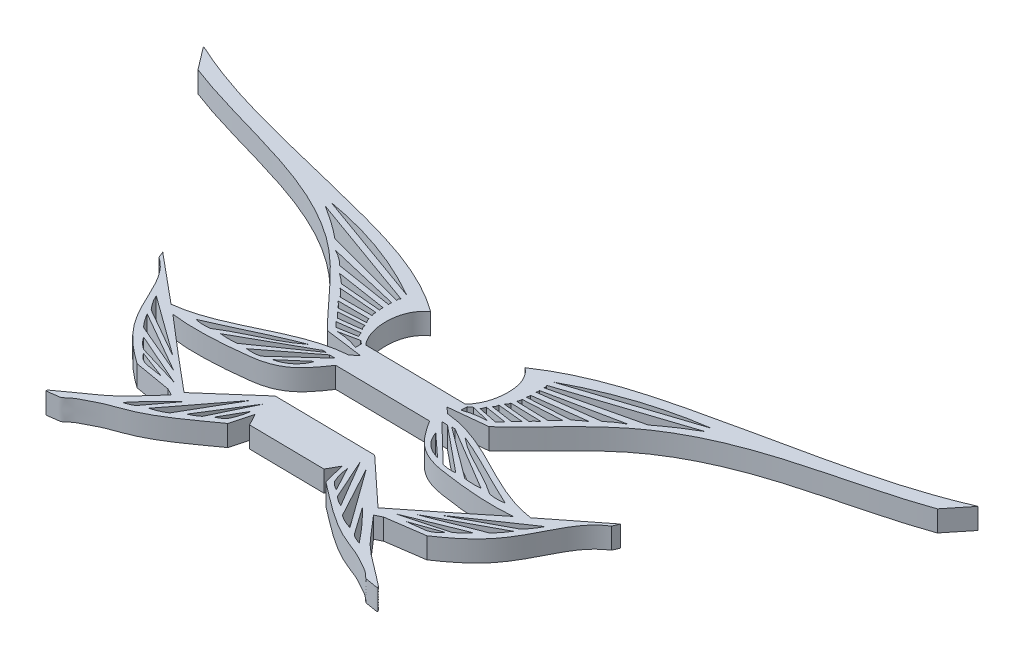
from build123d import *

# Parameters (mm, degrees)
EXTRUDE_2_DEPTH = 5


with BuildPart() as part:
    # 草图1 → 凸台-拉伸2 (new body)
    with BuildSketch(Plane(origin=(0, 0, 0), x_dir=(1, 0, 0), z_dir=(0, 1, 0))):
        with BuildLine():
            Line((-16.103773819, -29.898359089), (-14.490886088, -30.755289496))
            add(Edge.make_bspline(
                [(-14.490886088, -30.755289496), (-20.884669309, -37.499295163), (-18.447995148, -36.236440216), (-31.189451968, -45.028910304), (-26.993954421, -44.438191538), (-27.357635824, -44.648190251), (-25.248865907, -42.845555476), (-23.405980948, -42.044069648), (-20.595558929, -40.429081018), (-12.612070301, -38.071297427), (-6.528604055, -33.194707099), (-1.848850836, -29.898359089)],
                knots=[0, 0, 0, 0, 0.138213288, 0.158313918, 0.168524285, 0.240316957, 0.287507408, 0.343449858, 0.409538759, 0.538479735, 1, 1, 1, 1], degree=3))
            Line((-1.848850836, -29.898359089), (-0.445645395, -24.742363794))
            Line((-0.445645395, -24.742363794), (1.065498926, -27.584754302))
            Line((1.065498926, -27.584754302), (19.077453467, -27.839259259))
            Line((19.077453467, -27.839259259), (20.668303178, -25.040699244))
            Line((20.668303178, -25.040699244), (21.925271354, -30.234282207))
            add(Edge.make_bspline(
                [(34.538047989, -31.448057553), (40.738734082, -38.370020301), (38.338713296, -37.038823918), (50.82666171, -46.187779954), (46.649529217, -45.478757766), (47.007132144, -45.698948069), (44.950135591, -43.83745193), (43.130631467, -42.984217349), (40.366961188, -41.290468021), (32.453276369, -38.708060865), (26.510021564, -33.661535614), (21.925271354, -30.234282207)],
                knots=[0, 0, 0, 0, 0.138213288, 0.158313918, 0.168524285, 0.240316957, 0.287507408, 0.343449858, 0.409538759, 0.538479735, 1, 1, 1, 1], degree=3))
            Line((34.538047989, -31.448057553), (36.174503464, -30.63703965))
            Line((36.174503464, -30.63703965), (45.171670829, -29.346902954))
            add(Edge.make_bspline(
                [(65.249495162, -5.273250668), (61.766263907, -7.501627612), (58.752904031, -13.633337302), (53.744023944, -23.084612304), (48.232629608, -27.292598923), (45.171670829, -29.346902954)],
                knots=[0, 0, 0, 0, 0.362458305, 0.64917474, 1, 1, 1, 1], degree=3))
            Line((65.249495162, -5.273250668), (65.893558852, -3.785938561))
            Line((65.893558852, -3.785938561), (53.873583233, -13.221108944))
            add(Edge.make_bspline(
                [(22.461513178, -1.624515792), (33.855828878, -2.720380763), (42.541642387, -11.597724795), (53.873583233, -13.221108944)],
                knots=[0, 0, 0, 0, 1, 1, 1, 1], degree=3))
            Line((22.461513178, -1.624515792), (20.921904443, -0.295621909))
            Line((20.921904443, -0.295621909), (30.060393929, 0.666159162))
            add(Edge.make_bspline(
                [(100.611993759, 37.211299403), (88.298262435, 32.83638113), (69.501657366, 30.01745681), (45.090813635, 17.335397796), (36.097400095, 6.236393186), (30.060393929, 0.666159162)],
                knots=[0, 0, 0, 0, 0.482735813, 0.695059024, 1, 1, 1, 1], degree=3))
            Line((100.611993759, 37.211299403), (104.954981583, 42.59415762))
            add(Edge.make_bspline(
                [(22.144921218, 17.160212546), (31.525905639, 23.57487669), (47.510430234, 27.686769801), (75.810112282, 33.739350726), (93.315699901, 37.547379753), (104.954981583, 42.59415762)],
                knots=[0, 0, 0, 0, 0.384359586, 0.564437476, 1, 1, 1, 1], degree=3))
            add(Edge.make_bspline(
                [(22.144921218, 17.160212546), (24.509893208, 15.323249999), (25.990560817, 9.903430905), (24.36483621, 4.419213059), (22.577706713, 2.486317386)],
                knots=[0, 0, 0, 0, 0.513587115, 1, 1, 1, 1], degree=3))
            Line((22.577706713, 2.486317386), (-1.57654055, 2.827611588))
            add(Edge.make_bspline(
                [(-0.729332783, 17.483420725), (-3.145262015, 15.71401126), (-4.778469642, 10.338190539), (-3.308344707, 4.81022902), (-1.57654055, 2.827611588)],
                knots=[0, 0, 0, 0, 0.513587115, 1, 1, 1, 1], degree=3))
            add(Edge.make_bspline(
                [(-0.729332783, 17.483420725), (-9.925332708, 24.160573572), (-25.787298838, 28.722450593), (-53.904673908, 35.572192129), (-71.295681173, 39.873302368), (-82.787724947, 45.246920776)],
                knots=[0, 0, 0, 0, 0.384359586, 0.564437476, 1, 1, 1, 1], degree=3))
            Line((-82.787724947, 45.246920776), (-78.598557779, 39.743505086))
            add(Edge.make_bspline(
                [(-78.598557779, 39.743505086), (-66.413350951, 35.022422204), (-47.703895554, 31.673545498), (-23.661115032, 18.306847429), (-14.984882238, 6.958174602), (-9.107667118, 1.219595251)],
                knots=[0, 0, 0, 0, 0.482735813, 0.695059024, 1, 1, 1, 1], degree=3))
            Line((-9.107667118, 1.219595251), (0, 0))
            Line((0, 0), (-1.57654055, -1.284863379))
            add(Edge.make_bspline(
                [(-1.57654055, -1.284863379), (-12.997269873, -2.058356781), (-21.930435578, -10.686748512), (-33.303719432, -11.989312829)],
                knots=[0, 0, 0, 0, 1, 1, 1, 1], degree=3))
            Line((-33.303719432, -11.989312829), (-45.052315875, -2.218297749))
            Line((-45.052315875, -2.218297749), (-44.450531705, -3.723213413))
            add(Edge.make_bspline(
                [(-44.450531705, -3.723213413), (-41.031651414, -6.049115675), (-38.192739367, -12.263516681), (-33.452894494, -21.852539022), (-28.062592541, -26.214564213), (-25.060897902, -28.354532203)],
                knots=[0, 0, 0, 0, 0.362458305, 0.64917474, 1, 1, 1, 1], degree=3))
            Line((-25.060897902, -28.354532203), (-16.103773819, -29.898359089))
        make_face()
        with BuildLine():
            Line((-35.182838385, 28.178383105), (-7.096711501, 18.095243558))
            add(Edge.make_bspline(
                [(-35.182838385, 28.178383105), (-20.248090795, 25.642813669), (-7.096711501, 18.095243558)],
                knots=[0, 0, 0, 1, 1, 1], degree=2))
        make_face(mode=Mode.SUBTRACT)
        with BuildLine():
            Line((-27.226324633, 21.101852441), (-7.096711501, 15.748621991))
            add(Edge.make_bspline(
                [(-6.962377893, 16.59490624), (-7.386571889, 16.214051513), (-7.096711501, 15.748621991)],
                knots=[0, 0, 0, 1, 1, 1], degree=2))
            Line((-6.962377893, 16.59490624), (-35.182838385, 26.748410587))
            add(Edge.make_bspline(
                [(-35.182838385, 26.748410587), (-31.011643798, 24.200471227), (-27.226324633, 21.101852441)],
                knots=[0, 0, 0, 1, 1, 1], degree=2))
        make_face(mode=Mode.SUBTRACT)
        with BuildLine():
            Line((-21.139774943, 16.152868078), (-7.096711501, 13.89645491))
            add(Edge.make_bspline(
                [(-7.212800722, 14.662905206), (-7.429805602, 14.248762569), (-7.096711501, 13.89645491)],
                knots=[0, 0, 0, 1, 1, 1], degree=2))
            Line((-7.212800722, 14.662905206), (-24.774009417, 18.797669248))
            add(Edge.make_bspline(
                [(-24.774009417, 18.797669248), (-22.73761671, 17.753086901), (-21.139774943, 16.152868078)],
                knots=[0, 0, 0, 1, 1, 1], degree=2))
        make_face(mode=Mode.SUBTRACT)
        with BuildLine():
            Line((-17.203335074, 12.610095473), (-7.096711501, 11.704444121))
            add(Edge.make_bspline(
                [(-7.212800722, 12.610095473), (-7.346401022, 12.118621353), (-7.096711501, 11.704444121)],
                knots=[0, 0, 0, 1, 1, 1], degree=2))
            Line((-7.212800722, 12.610095473), (-19.618405347, 14.542151692))
            add(Edge.make_bspline(
                [(-19.618405347, 14.542151692), (-18.328722121, 13.678456736), (-17.203335074, 12.610095473)],
                knots=[0, 0, 0, 1, 1, 1], degree=2))
        make_face(mode=Mode.SUBTRACT)
        with BuildLine():
            Line((-14.568441476, 9.684985554), (-6.878909657, 9.684985554))
            add(Edge.make_bspline(
                [(-7.096711501, 10.758541597), (-7.210272787, 10.172545053), (-6.878909657, 9.684985554)],
                knots=[0, 0, 0, 1, 1, 1], degree=2))
            Line((-7.096711501, 10.758541597), (-16.415490281, 11.532034359))
            add(Edge.make_bspline(
                [(-16.415490281, 11.532034359), (-15.39023398, 10.70783761), (-14.568441476, 9.684985554)],
                knots=[0, 0, 0, 1, 1, 1], degree=2))
        make_face(mode=Mode.SUBTRACT)
        with BuildLine():
            Line((-12.597455703, 7.173307626), (-6.033635061, 7.598824657))
            add(Edge.make_bspline(
                [(-6.577025872, 8.645355108), (-6.588564664, 7.987642833), (-6.033635061, 7.598824657)],
                knots=[0, 0, 0, 1, 1, 1], degree=2))
            Line((-6.577025872, 8.645355108), (-14.069503186, 8.645355108))
            add(Edge.make_bspline(
                [(-14.069503186, 8.645355108), (-13.220747499, 8.018539858), (-12.597455703, 7.173307626)],
                knots=[0, 0, 0, 1, 1, 1], degree=2))
        make_face(mode=Mode.SUBTRACT)
        with BuildLine():
            Line((-10.561891823, 5.002624113), (-5.127983709, 5.656705645))
            add(Edge.make_bspline(
                [(-5.651248934, 6.753550061), (-5.724038036, 6.080064551), (-5.127983709, 5.656705645)],
                knots=[0, 0, 0, 1, 1, 1], degree=2))
            Line((-5.651248934, 6.753550061), (-11.870054888, 6.310787178))
            add(Edge.make_bspline(
                [(-11.870054888, 6.310787178), (-11.164820436, 5.706807997), (-10.561891823, 5.002624113)],
                knots=[0, 0, 0, 1, 1, 1], degree=2))
        make_face(mode=Mode.SUBTRACT)
        with BuildLine():
            Line((-36.84765898, -11.989312829), (-22.414436084, -22.449877147))
            Line((-22.414436084, -22.449877147), (-34.46516185, -15.573723069))
            add(Edge.make_bspline(
                [(-36.84765898, -11.989312829), (-35.929119346, -13.978075815), (-34.46516185, -15.573723069)],
                knots=[0, 0, 0, 1, 1, 1], degree=2))
        make_face(mode=Mode.SUBTRACT)
        with BuildLine():
            Line((-8.763785997, 2.936617502), (-4.222332356, 3.73471222))
            add(Edge.make_bspline(
                [(-4.624844068, 4.801368257), (-4.476594662, 4.247232566), (-4.222332356, 3.73471222)],
                knots=[0, 0, 0, 1, 1, 1], degree=2))
            Line((-4.624844068, 4.801368257), (-9.944266841, 4.117098346))
            add(Edge.make_bspline(
                [(-9.944266841, 4.117098346), (-9.328370075, 3.552076692), (-8.763785997, 2.936617502)],
                knots=[0, 0, 0, 1, 1, 1], degree=2))
        make_face(mode=Mode.SUBTRACT)
        with BuildLine():
            Line((-7.72998178, 2.222902012), (-3.135550733, 3.171195822))
            Line((-3.135550733, 3.171195822), (-2.31624848, 2.539010698))
            Line((-2.31624848, 2.539010698), (-2.31624848, 1.09027332))
            add(Edge.make_bspline(
                [(-7.72998178, 2.222902012), (-4.908530756, 2.12376403), (-2.31624848, 1.09027332)],
                knots=[0, 0, 0, 1, 1, 1], degree=2))
        make_face(mode=Mode.SUBTRACT)
        with BuildLine():
            Line((-21.277849249, -12.169413542), (-5.619725363, -3.409622108))
            Line((-5.619725363, -3.409622108), (-4.777911564, -3.409622108))
            Line((-4.777911564, -3.409622108), (-17.294022325, -12.185739206))
            add(Edge.make_bspline(
                [(-21.277849249, -12.169413542), (-19.284856232, -12.422115128), (-17.294022325, -12.185739206)],
                knots=[0, 0, 0, 1, 1, 1], degree=2))
        make_face(mode=Mode.SUBTRACT)
        with BuildLine():
            Line((-15.060534866, -12.169413542), (-3.907902416, -3.560230994))
            Line((-3.907902416, -3.560230994), (-2.533839168, -3.560230994))
            Line((-2.533839168, -3.560230994), (-11.775299344, -11.989312829))
            add(Edge.make_bspline(
                [(-15.060534866, -12.169413542), (-13.387909137, -12.414610369), (-11.775299344, -11.989312829)],
                knots=[0, 0, 0, 1, 1, 1], degree=2))
        make_face(mode=Mode.SUBTRACT)
        with BuildLine():
            Line((-9.696270638, -11.331649493), (-4.222332356, -6.583488886))
            add(Edge.make_bspline(
                [(-4.222332356, -6.583488886), (-5.675921625, -10.412613855), (-9.696270638, -11.331649493)],
                knots=[0, 0, 0, 1, 1, 1], degree=2))
        make_face(mode=Mode.SUBTRACT)
        with BuildLine():
            Line((-34.190967534, -16.812533396), (-19.152491915, -25.453678758))
            Line((-19.152491915, -25.453678758), (-31.801181639, -20.077041431))
            add(Edge.make_bspline(
                [(-34.190967534, -16.812533396), (-33.148322725, -18.557993128), (-31.801181639, -20.077041431)],
                knots=[0, 0, 0, 1, 1, 1], degree=2))
        make_face(mode=Mode.SUBTRACT)
        with BuildLine():
            Line((-29.805020775, -22.059096425), (-16.825789187, -27.761152537))
            Line((-16.825789187, -27.761152537), (-27.226324633, -24.629598887))
            add(Edge.make_bspline(
                [(-29.805020775, -22.059096425), (-28.753568462, -23.570254947), (-27.226324633, -24.629598887)],
                knots=[0, 0, 0, 1, 1, 1], degree=2))
        make_face(mode=Mode.SUBTRACT)
        with BuildLine():
            Line((-26.403696421, -25.453678758), (-19.618405347, -28.040940898))
            Line((-19.618405347, -28.040940898), (-23.753393557, -27.400982827))
            add(Edge.make_bspline(
                [(-26.403696421, -25.453678758), (-25.454954951, -26.959998203), (-23.753393557, -27.400982827)],
                knots=[0, 0, 0, 1, 1, 1], degree=2))
        make_face(mode=Mode.SUBTRACT)
        with BuildLine():
            Line((-3.907902416, -22.449877147), (-14.415839762, -36.170569033))
            add(Edge.make_bspline(
                [(-14.415839762, -36.170569033), (-12.54622165, -35.702818924), (-10.955616626, -34.661907538)],
                knots=[0, 0, 0, 1, 1, 1], degree=2))
            Line((-10.955616626, -34.661907538), (-3.907902416, -22.449877147))
        make_face(mode=Mode.SUBTRACT)
        with BuildLine():
            Line((-16.488222725, -37.137514335), (-11.459063089, -30.418720963))
            add(Edge.make_bspline(
                [(-11.459063089, -30.418720963), (-15.368555435, -34.053202491), (-18.795038149, -38.140885271)],
                knots=[0, 0, 0, 1, 1, 1], degree=2))
            add(Edge.make_bspline(
                [(-18.795038149, -38.140885271), (-17.56459076, -37.811943726), (-16.488222725, -37.137514335)],
                knots=[0, 0, 0, 1, 1, 1], degree=2))
        make_face(mode=Mode.SUBTRACT)
        with BuildLine():
            Line((-8.667555799, -32.861466231), (-1.57654055, -21.581573034))
            Line((-1.57654055, -21.581573034), (-6.351363076, -31.473626057))
            add(Edge.make_bspline(
                [(-8.667555799, -32.861466231), (-7.397877731, -32.343744937), (-6.351363076, -31.473626057)],
                knots=[0, 0, 0, 1, 1, 1], degree=2))
        make_face(mode=Mode.SUBTRACT)
        with BuildLine():
            Line((-4.777911564, -30.21116539), (-1.57654055, -24.629598887))
            add(Edge.make_bspline(
                [(-1.57654055, -24.629598887), (-1.819327272, -26.800151593), (-2.780160589, -28.727289228)],
                knots=[0, 0, 0, 1, 1, 1], degree=2))
            add(Edge.make_bspline(
                [(-4.777911564, -30.21116539), (-3.582687149, -29.722654584), (-2.780160589, -28.727289228)],
                knots=[0, 0, 0, 1, 1, 1], degree=2))
        make_face(mode=Mode.SUBTRACT)
        with BuildLine():
            Line((30.893812613, -35.25323077), (24.193949723, -22.846950138))
            Line((24.193949723, -22.846950138), (34.310028753, -36.85905484))
            add(Edge.make_bspline(
                [(34.310028753, -36.85905484), (32.454372807, -36.338667427), (30.893812613, -35.25323077)],
                knots=[0, 0, 0, 1, 1, 1], degree=2))
        make_face(mode=Mode.SUBTRACT)
        with BuildLine():
            Line((26.381478628, -31.936133912), (21.888051582, -21.913122561))
            Line((21.888051582, -21.913122561), (28.657534752, -33.388861553))
            add(Edge.make_bspline(
                [(28.657534752, -33.388861553), (27.402991223, -32.835473562), (26.381478628, -31.936133912)],
                knots=[0, 0, 0, 1, 1, 1], degree=2))
        make_face(mode=Mode.SUBTRACT)
        with BuildLine():
            Line((24.844324734, -30.629721074), (21.801932905, -24.959931575))
            add(Edge.make_bspline(
                [(21.801932905, -24.959931575), (21.983296081, -27.136477427), (22.889296622, -29.089993014)],
                knots=[0, 0, 0, 1, 1, 1], degree=2))
            add(Edge.make_bspline(
                [(24.844324734, -30.629721074), (23.663379823, -30.107635518), (22.889296622, -29.089993014)],
                knots=[0, 0, 0, 1, 1, 1], degree=2))
        make_face(mode=Mode.SUBTRACT)
        with BuildLine():
            Line((36.354264381, -37.884167057), (31.51694474, -31.025962503))
            add(Edge.make_bspline(
                [(31.51694474, -31.025962503), (35.322187984, -34.769451548), (38.631809713, -38.952314003)],
                knots=[0, 0, 0, 1, 1, 1], degree=2))
            add(Edge.make_bspline(
                [(38.631809713, -38.952314003), (37.411147433, -38.588738817), (36.354264381, -37.884167057)],
                knots=[0, 0, 0, 1, 1, 1], degree=2))
        make_face(mode=Mode.SUBTRACT)
        with BuildLine():
            Line((39.740211218, -28.879665096), (43.891629975, -28.356792134))
            add(Edge.make_bspline(
                [(46.595893752, -26.485146914), (45.604971612, -27.964059339), (43.891629975, -28.356792134)],
                knots=[0, 0, 0, 1, 1, 1], degree=2))
            Line((46.595893752, -26.485146914), (39.740211218, -28.879665096))
        make_face(mode=Mode.SUBTRACT)
        with BuildLine():
            Line((36.956615049, -28.521086082), (47.44147704, -25.684638504))
            add(Edge.make_bspline(
                [(50.091770479, -23.188020515), (48.998041778, -24.668868101), (47.44147704, -25.684638504)],
                knots=[0, 0, 0, 1, 1, 1], degree=2))
            Line((50.091770479, -23.188020515), (36.956615049, -28.521086082))
        make_face(mode=Mode.SUBTRACT)
        with BuildLine():
            Line((39.347584084, -26.280271967), (52.143135254, -21.263156169))
            add(Edge.make_bspline(
                [(54.624202241, -18.067472213), (53.5326576, -19.782776318), (52.143135254, -21.263156169)],
                knots=[0, 0, 0, 1, 1, 1], degree=2))
            Line((54.624202241, -18.067472213), (39.347584084, -26.280271967))
        make_face(mode=Mode.SUBTRACT)
        with BuildLine():
            Line((30.29414061, -11.896705209), (24.956541789, -6.995779961))
            add(Edge.make_bspline(
                [(24.956541789, -6.995779961), (26.301362966, -10.864445854), (30.29414061, -11.896705209)],
                knots=[0, 0, 0, 1, 1, 1], degree=2))
        make_face(mode=Mode.SUBTRACT)
        with BuildLine():
            Line((23.354141569, -3.926022469), (32.353757756, -12.612846701))
            add(Edge.make_bspline(
                [(35.63259319, -12.885696293), (33.953707438, -13.083537), (32.353757756, -12.612846701)],
                knots=[0, 0, 0, 1, 1, 1], degree=2))
            Line((35.63259319, -12.885696293), (24.727656261, -3.964845141))
            Line((24.727656261, -3.964845141), (23.354141569, -3.926022469))
        make_face(mode=Mode.SUBTRACT)
        with BuildLine():
            Line((25.601573374, -3.83887755), (37.864727729, -12.965120214))
            add(Edge.make_bspline(
                [(41.847425486, -13.061359792), (39.848088305, -13.257650631), (37.864727729, -12.965120214)],
                knots=[0, 0, 0, 1, 1, 1], degree=2))
            Line((41.847425486, -13.061359792), (26.443051103, -3.862662089))
            Line((26.443051103, -3.862662089), (25.601573374, -3.83887755))
        make_face(mode=Mode.SUBTRACT)
        with BuildLine():
            Line((42.693095183, -23.369832246), (54.93328834, -16.836903511))
            add(Edge.make_bspline(
                [(57.416107963, -13.321239126), (56.441744682, -15.28325581), (54.93328834, -16.836903511)],
                knots=[0, 0, 0, 1, 1, 1], degree=2))
            Line((57.416107963, -13.321239126), (42.693095183, -23.369832246))
        make_face(mode=Mode.SUBTRACT)
        with BuildLine():
            Line((23.30896523, 2.176932064), (23.268032721, 0.728773053))
            add(Edge.make_bspline(
                [(28.711605941, 1.707990391), (25.888480265, 1.688609037), (23.268032721, 0.728773053)],
                knots=[0, 0, 0, 1, 1, 1], degree=2))
            Line((28.711605941, 1.707990391), (24.145802108, 2.785716306))
            Line((24.145802108, 2.785716306), (23.30896523, 2.176932064))
        make_face(mode=Mode.SUBTRACT)
        with BuildLine():
            Line((30.978525482, 3.53886829), (25.680559645, 4.373159567))
            add(Edge.make_bspline(
                [(25.680559645, 4.373159567), (25.556150915, 3.804573877), (25.24807141, 3.318301895)],
                knots=[0, 0, 0, 1, 1, 1], degree=2))
            Line((25.24807141, 3.318301895), (29.765162701, 2.39221193))
            add(Edge.make_bspline(
                [(30.978525482, 3.53886829), (30.346910519, 2.991473702), (29.765162701, 2.39221193)],
                knots=[0, 0, 0, 1, 1, 1], degree=2))
        make_face(mode=Mode.SUBTRACT)
        with BuildLine():
            Line((32.965525019, 5.677270293), (26.761711535, 6.295562058))
            add(Edge.make_bspline(
                [(26.761711535, 6.295562058), (26.815442972, 5.62028884), (26.207665054, 5.213939819)],
                knots=[0, 0, 0, 1, 1, 1], degree=2))
            Line((26.207665054, 5.213939819), (31.620923468, 4.406590209))
            add(Edge.make_bspline(
                [(32.965525019, 5.677270293), (32.243507334, 5.093457872), (31.620923468, 4.406590209)],
                knots=[0, 0, 0, 1, 1, 1], degree=2))
        make_face(mode=Mode.SUBTRACT)
        with BuildLine():
            Line((37.656666473, 10.768006675), (28.319753749, 10.258114732))
            add(Edge.make_bspline(
                [(28.319753749, 10.258114732), (28.416713, 9.669143579), (28.07170669, 9.191141031)],
                knots=[0, 0, 0, 1, 1, 1], degree=2))
            Line((28.07170669, 9.191141031), (35.758168681, 8.97388162))
            add(Edge.make_bspline(
                [(37.656666473, 10.768006675), (36.608532688, 9.973106472), (35.758168681, 8.97388162)],
                knots=[0, 0, 0, 1, 1, 1], degree=2))
        make_face(mode=Mode.SUBTRACT)
        with BuildLine():
            Line((35.230055944, 7.948763179), (27.74056979, 8.160455028))
            add(Edge.make_bspline(
                [(27.74056979, 8.160455028), (27.733521025, 7.50267931), (27.167827325, 7.129695294)],
                knots=[0, 0, 0, 1, 1, 1], degree=2))
            Line((27.167827325, 7.129695294), (33.717005024, 6.518894481))
            add(Edge.make_bspline(
                [(35.230055944, 7.948763179), (34.363929112, 7.346178842), (33.717005024, 6.518894481)],
                knots=[0, 0, 0, 1, 1, 1], degree=2))
        make_face(mode=Mode.SUBTRACT)
        with BuildLine():
            Line((40.943350478, 13.6864274), (28.488110279, 12.105649452))
            add(Edge.make_bspline(
                [(28.488110279, 12.105649452), (28.607771173, 11.610596806), (28.346479203, 11.203639631)],
                knots=[0, 0, 0, 1, 1, 1], degree=2))
            Line((28.346479203, 11.203639631), (38.474656193, 11.823377701))
            add(Edge.make_bspline(
                [(40.943350478, 13.6864274), (39.629779353, 12.859515856), (38.474656193, 11.823377701)],
                knots=[0, 0, 0, 1, 1, 1], degree=2))
        make_face(mode=Mode.SUBTRACT)
        with BuildLine():
            Line((46.217131368, 17.794580041), (28.546110199, 14.157639658))
            add(Edge.make_bspline(
                [(28.546110199, 14.157639658), (28.751327293, 13.737531118), (28.408412098, 13.394775322)],
                knots=[0, 0, 0, 1, 1, 1], degree=2))
            Line((28.408412098, 13.394775322), (42.509621761, 15.2535161))
            add(Edge.make_bspline(
                [(46.217131368, 17.794580041), (44.152038088, 16.807950789), (42.509621761, 15.2535161)],
                knots=[0, 0, 0, 1, 1, 1], degree=2))
        make_face(mode=Mode.SUBTRACT)
        with BuildLine():
            Line((48.733569773, 20.028555838), (28.460743078, 15.246202977))
            add(Edge.make_bspline(
                [(28.350373945, 16.095944822), (28.763637955, 15.703256997), (28.460743078, 15.246202977)],
                knots=[0, 0, 0, 1, 1, 1], degree=2))
            Line((28.350373945, 16.095944822), (56.84644451, 25.448057059))
            add(Edge.make_bspline(
                [(56.84644451, 25.448057059), (52.604925881, 23.018987485), (48.733569773, 20.028555838)],
                knots=[0, 0, 0, 1, 1, 1], degree=2))
        make_face(mode=Mode.SUBTRACT)
        with BuildLine():
            Line((56.886846838, 26.8774587), (28.527044334, 17.591887722))
            add(Edge.make_bspline(
                [(56.886846838, 26.8774587), (41.886421749, 24.764866671), (28.527044334, 17.591887722)],
                knots=[0, 0, 0, 1, 1, 1], degree=2))
        make_face(mode=Mode.SUBTRACT)
        with BuildLine():
            Line((-0.985903289, -4.958111164), (21.767328065, -5.27960932))
            add(Edge.make_bspline(
                [(51.514970035, -15.027015613), (46.003668635, -15.514090272), (37.648914264, -14.774177187), (29.707301923, -13.418699286), (24.917056729, -10.135076162), (23.125564629, -7.402443737), (21.767328065, -5.27960932)],
                knots=[0, 0, 0, 0, 0.521809523, 0.750761498, 0.78753114, 1, 1, 1, 1], degree=3))
            add(Edge.make_bspline(
                [(51.514970035, -15.027015613), (42.607353534, -22.294292787), (33.563857978, -29.391711661)],
                knots=[0, 0, 0, 1, 1, 1], degree=2))
            Line((33.563857978, -29.391711661), (22.246165704, -18.881300023))
            Line((22.246165704, -18.881300023), (-1.848850836, -18.540842738))
            Line((-1.848850836, -18.540842738), (-13.458985163, -28.727289228))
            add(Edge.make_bspline(
                [(-30.997071786, -13.861138608), (-22.298340461, -21.377189604), (-13.458985163, -28.727289228)],
                knots=[0, 0, 0, 1, 1, 1], degree=2))
            add(Edge.make_bspline(
                [(-30.997071786, -13.861138608), (-25.501732384, -14.50373468), (-17.129407968, -14.00017154), (-9.152668528, -12.869616449), (-4.27156048, -9.72264742), (-2.403576007, -7.041722594), (-0.985903289, -4.958111164)],
                knots=[0, 0, 0, 0, 0.521809523, 0.750761498, 0.78753114, 1, 1, 1, 1], degree=3))
        make_face(mode=Mode.SUBTRACT)
        with BuildLine():
            add(Edge.make_bspline(
                [(-27.226324633, -12.169413542), (-20.950326675, -9.519893491), (-14.926042611, -6.272985991), (-8.538140323, -3.884202973)],
                knots=[0, 0, 0, 0, 1, 1, 1, 1], degree=3))
            add(Edge.make_bspline(
                [(-8.538140323, -3.884202973), (-13.103340217, -7.47297977), (-18.759909816, -9.130831844), (-23.580875914, -12.298626313)],
                knots=[0, 0, 0, 0, 1, 1, 1, 1], degree=3))
            add(Edge.make_bspline(
                [(-27.226324633, -12.169413542), (-25.405158362, -12.556798943), (-23.580875914, -12.298626313)],
                knots=[0, 0, 0, 1, 1, 1], degree=2))
        make_face(mode=Mode.SUBTRACT)
        with BuildLine():
            add(Edge.make_bspline(
                [(47.79352611, -13.229427535), (45.962141732, -13.565203199), (44.145881966, -13.255590507)],
                knots=[0, 0, 0, 1, 1, 1], degree=2))
            add(Edge.make_bspline(
                [(29.346892199, -4.419510152), (33.808872556, -8.135839019), (39.416343111, -9.952849505), (44.145881966, -13.255590507)],
                knots=[0, 0, 0, 0, 1, 1, 1, 1], degree=3))
            add(Edge.make_bspline(
                [(47.79352611, -13.229427535), (41.594892992, -10.40364369), (35.664751815, -6.987822791), (29.346892199, -4.419510152)],
                knots=[0, 0, 0, 0, 1, 1, 1, 1], degree=3))
        make_face(mode=Mode.SUBTRACT)
    extrude(amount=EXTRUDE_2_DEPTH)


solid = part.part
